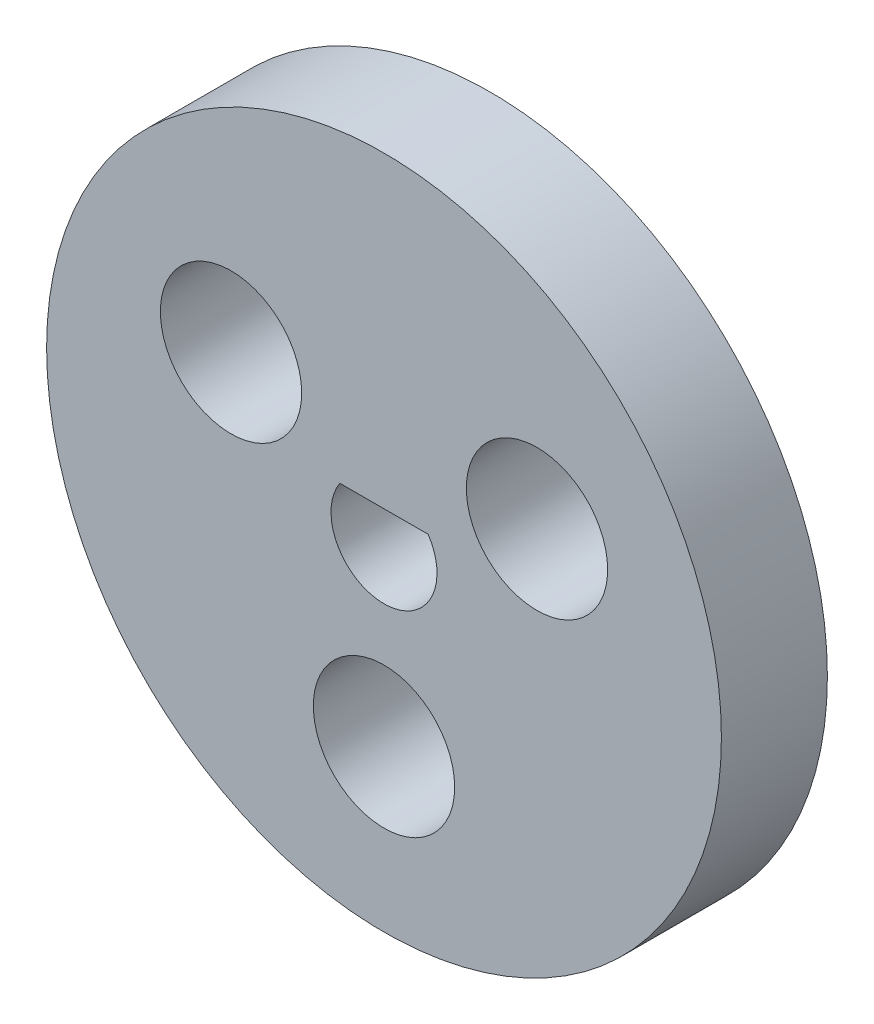
from build123d import *

# Parameters (mm, degrees)
SKETCH1_R           = 9.55
SKETCH1_R_2         = 2
BOSS_EXTRUDE1_DEPTH = 3


with BuildPart() as part:
    # Sketch1 → Boss-Extrude1 (new body)
    with BuildSketch(Plane.XY):
        Circle(SKETCH1_R)
        with BuildLine():
            Line((-1.25, 0.829156198), (1.25, 0.829156198))
            ThreePointArc((1.25, 0.829156198), (0, -1.5), (-1.25, 0.829156198))
        make_face(mode=Mode.SUBTRACT)
        with Locations((0, -5)):
            Circle(SKETCH1_R_2, mode=Mode.SUBTRACT)
        with Locations((-4.330127019, 2.5)):
            Circle(SKETCH1_R_2, mode=Mode.SUBTRACT)
        with Locations((4.330127019, 2.5)):
            Circle(SKETCH1_R_2, mode=Mode.SUBTRACT)
    extrude(amount=BOSS_EXTRUDE1_DEPTH)


solid = part.part
